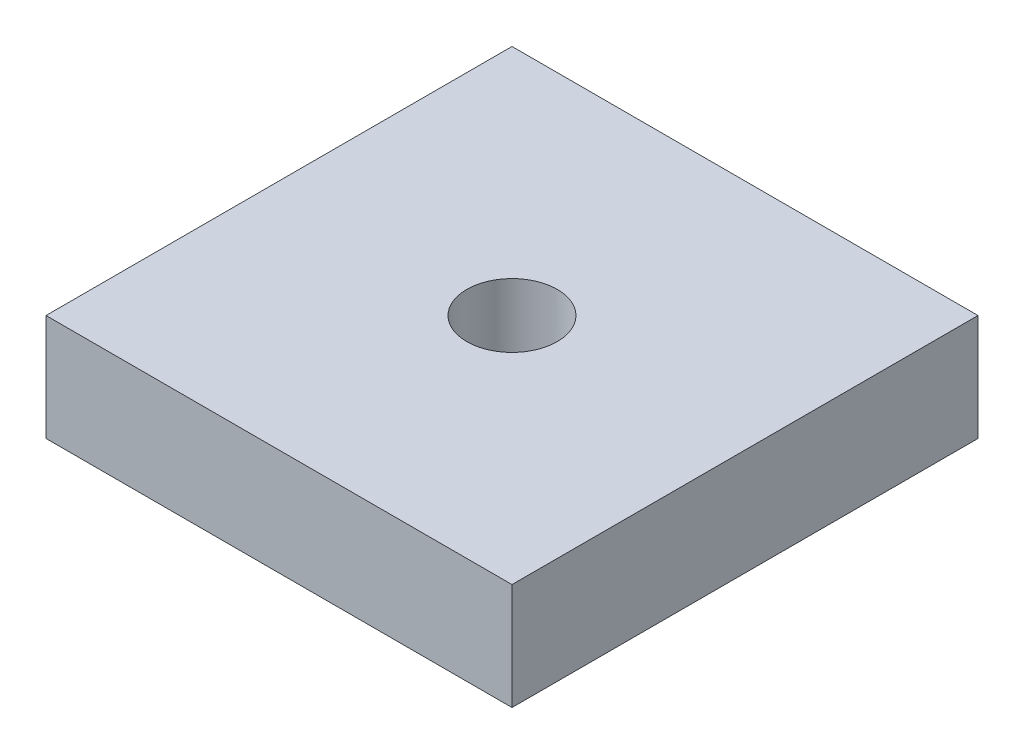
from build123d import *

# Parameters (mm, degrees)
SKETCH_1_W         = 35
SKETCH_1_H         = 35
EXTRUDE_1_DEPTH    = 8
HOLE_WIZARD_M8_1_D = 6.8


with BuildPart() as part:
    # 草图1 → 凸台-拉伸1 (new body)
    with BuildSketch(Plane(origin=(0, 0, 0), x_dir=(1, 0, 0), z_dir=(0, 1, 0))):
        Rectangle(SKETCH_1_W, SKETCH_1_H)
    extrude(amount=EXTRUDE_1_DEPTH)

    # M8 螺纹孔1 (through all)
    with Locations(Plane(origin=(0, 8, 0), x_dir=(1, 0, 0), z_dir=(0, 1, 0))):
        with Locations((0, 0)):
            Hole(HOLE_WIZARD_M8_1_D / 2)


solid = part.part
